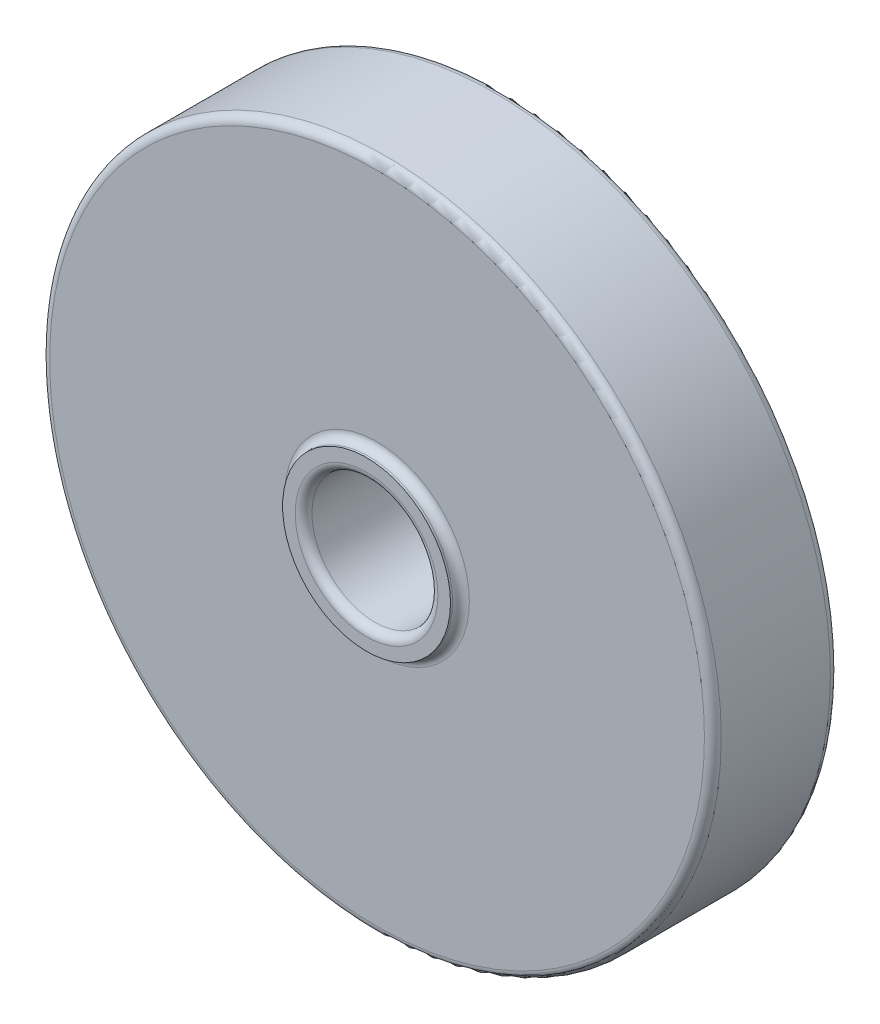
from build123d import *

# Parameters (mm, degrees)
ESQUISSE1_R      = 8
ESQUISSE1_R_2    = 1.5
EXTRUSION1_DEPTH = 3
ESQUISSE2_R      = 2
ESQUISSE2_R_2    = 1.5
EXTRUSION2_DEPTH = 0.25
CONG_1_R         = 0.2


with BuildPart() as part:
    # Esquisse1 → Extrusion1 (new body)
    with BuildSketch(Plane.XY):
        Circle(ESQUISSE1_R)
        Circle(ESQUISSE1_R_2, mode=Mode.SUBTRACT)
    extrude(amount=EXTRUSION1_DEPTH)

    # Esquisse2 → Extrusion2 (add)
    with BuildSketch(Plane.XY.offset(3)):
        Circle(ESQUISSE2_R)
        Circle(ESQUISSE2_R_2, mode=Mode.SUBTRACT)
    extrude(amount=EXTRUSION2_DEPTH)

    # Congé1
    cong_1_edges = [part.edges().sort_by_distance(p)[0] for p in [
        (-8, 0, 0),
        (-8, 0, 3),
        (-2, 0, 3),
        (-1.5, 0, 3.25),
        (-1.5, 0, 0),
    ]]
    fillet(cong_1_edges, radius=CONG_1_R)


solid = part.part
